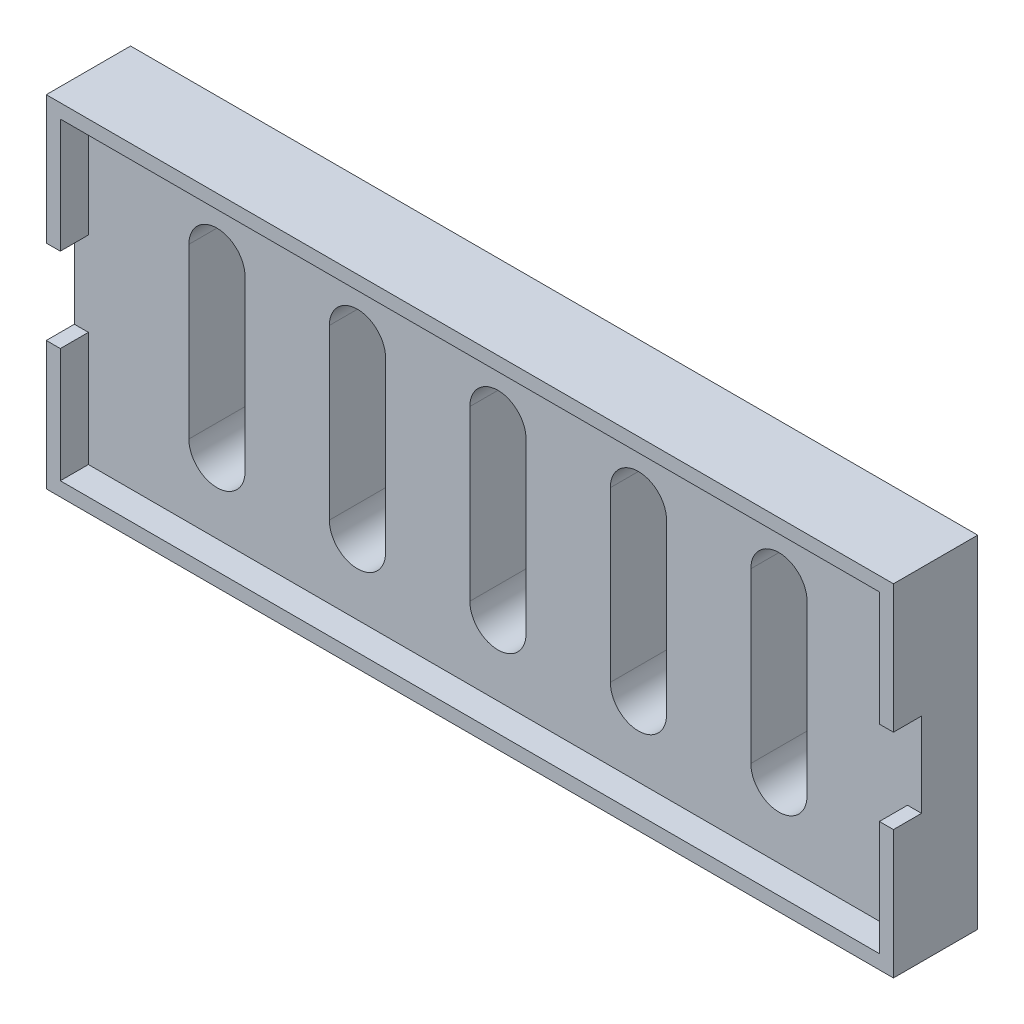
from build123d import *

# Parameters (mm, degrees)
SKETCH1_W           = 30.15
SKETCH1_H           = 12.15
BOSS_EXTRUDE1_DEPTH = 2
SKETCH2_W           = 30.15
SKETCH2_H           = 12.15
SKETCH2_W_2         = 29.15
SKETCH2_H_2         = 11.15
BOSS_EXTRUDE2_DEPTH = 1
CUT_EXTRUDE1_DEPTH  = 2
SKETCH4_W           = 0.5
SKETCH4_H           = 3
CUT_EXTRUDE2_DEPTH  = 1


with BuildPart() as part:
    # Sketch1 → Boss-Extrude1 (new body)
    with BuildSketch(Plane.XY):
        Rectangle(SKETCH1_W, SKETCH1_H)
    extrude(amount=BOSS_EXTRUDE1_DEPTH)

    # Sketch2 → Boss-Extrude2 (add)
    with BuildSketch(Plane.XY.offset(2)):
        Rectangle(SKETCH2_W, SKETCH2_H)
        Rectangle(SKETCH2_W_2, SKETCH2_H_2, mode=Mode.SUBTRACT)
    extrude(amount=BOSS_EXTRUDE2_DEPTH)

    # Sketch3 → Cut-Extrude1 (cut)
    with BuildSketch(Plane(origin=(0, 0, 0), x_dir=(-1, 0, 0), z_dir=(0, 0, -1))):
        with BuildLine():
            Line((-1, -3), (-1, 3))
            ThreePointArc((-1, 3), (0, 4), (1, 3))
            Line((1, 3), (1, -3))
            ThreePointArc((1, -3), (0, -4), (-1, -3))
        make_face()
        with BuildLine():
            Line((-6, -3), (-6, 3))
            ThreePointArc((-6, 3), (-5, 4), (-4, 3))
            Line((-4, 3), (-4, -3))
            ThreePointArc((-4, -3), (-5, -4), (-6, -3))
        make_face()
        with BuildLine():
            Line((-11, -3), (-11, 3))
            ThreePointArc((-11, 3), (-10, 4), (-9, 3))
            Line((-9, 3), (-9, -3))
            ThreePointArc((-9, -3), (-10, -4), (-11, -3))
        make_face()
        with BuildLine():
            Line((4, -3), (4, 3))
            ThreePointArc((4, 3), (5, 4), (6, 3))
            Line((6, 3), (6, -3))
            ThreePointArc((6, -3), (5, -4), (4, -3))
        make_face()
        with BuildLine():
            Line((9, -3), (9, 3))
            ThreePointArc((9, 3), (10, 4), (11, 3))
            Line((11, 3), (11, -3))
            ThreePointArc((11, -3), (10, -4), (9, -3))
        make_face()
    extrude(amount=-CUT_EXTRUDE1_DEPTH, mode=Mode.SUBTRACT)

    # Sketch4 → Cut-Extrude2 (cut)
    with BuildSketch(Plane.XY.offset(3)):
        with Locations((-14.825, 0)):
            Rectangle(SKETCH4_W, SKETCH4_H)
        with Locations((14.825, 0)):
            Rectangle(SKETCH4_W, SKETCH4_H)
    extrude(amount=-CUT_EXTRUDE2_DEPTH, mode=Mode.SUBTRACT)


solid = part.part
